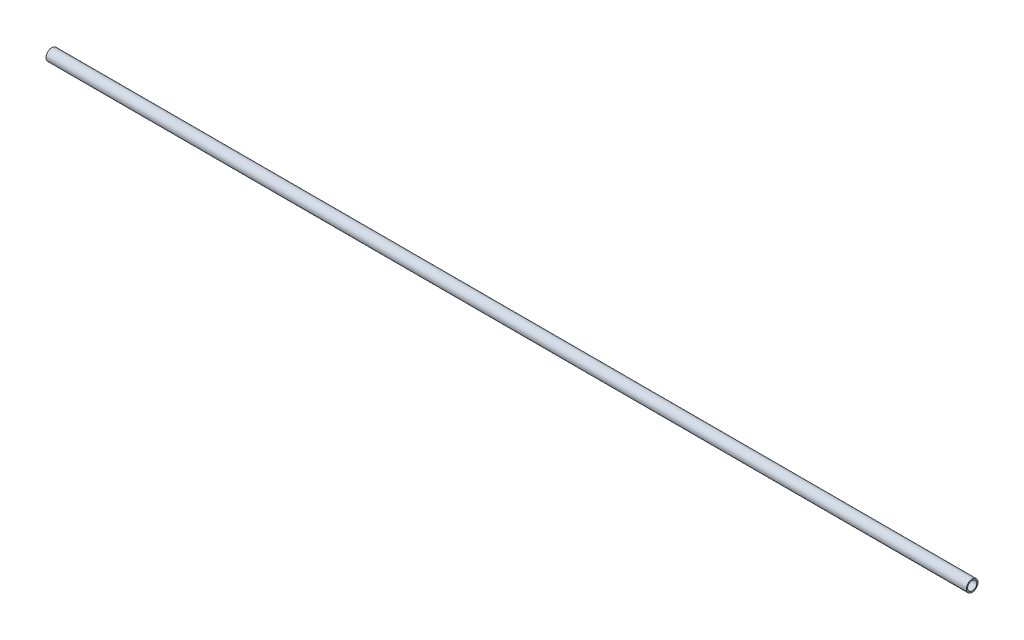
from build123d import *

# Parameters (mm, degrees)
CROQUIS1_R              = 19
CROQUIS1_R_2            = 15
SALIENTE_EXTRUIR1_DEPTH = 3000


with BuildPart() as part:
    # Croquis1 → Saliente-Extruir1 (new body)
    with BuildSketch(Plane(origin=(0, 0, 0), x_dir=(0, 0, -1), z_dir=(1, 0, 0))):
        Circle(CROQUIS1_R)
        Circle(CROQUIS1_R_2, mode=Mode.SUBTRACT)
    extrude(amount=SALIENTE_EXTRUIR1_DEPTH)


solid = part.part
